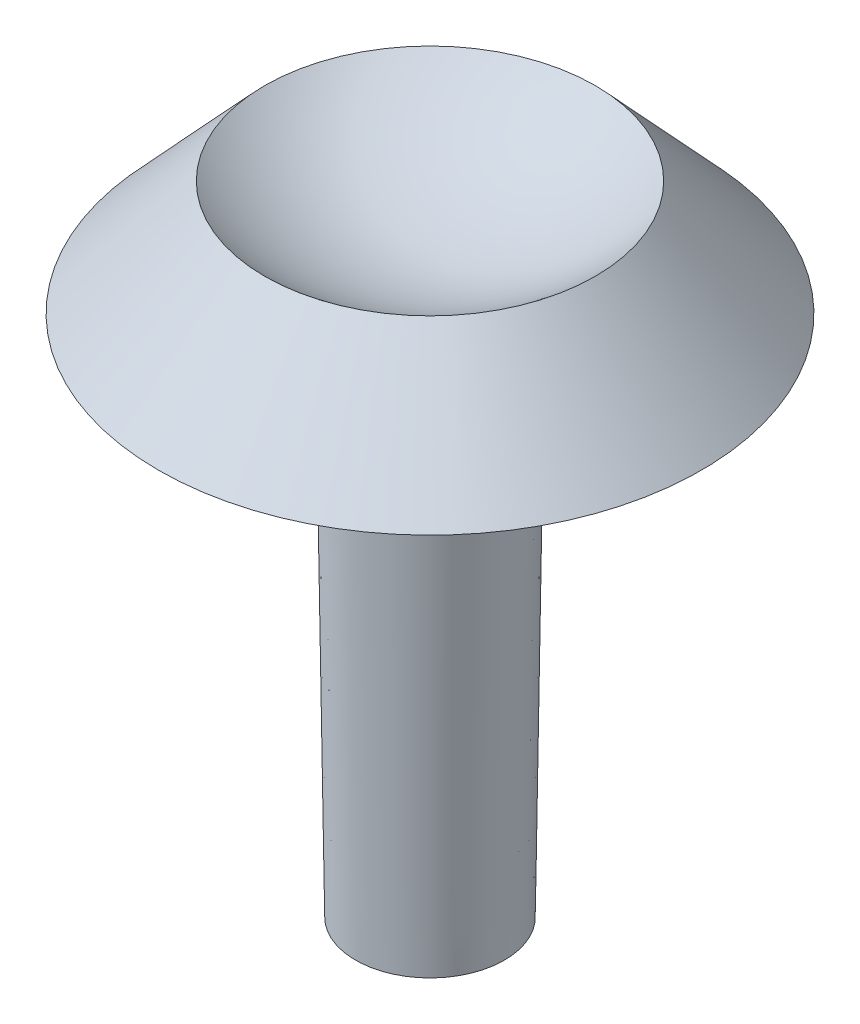
from build123d import *

# Parameters (mm, degrees)
BOSS_EXTRUDE4_DEPTH = 0.5


with BuildPart() as part:
    # Sketch1 → Revolve2 (revolve)
    with BuildSketch(Plane.XY, mode=Mode.PRIVATE) as revolve2_sk:
        with BuildLine():
            Line((2.9, -27.1), (2.9, -41.1))
            Line((2.9, -41.1), (4.8, -41.1))
            Line((4.8, -41.1), (5.25, -7.4))
            Line((5.25, -7.4), (5.25, -5.22209402))
            add(Edge.make_bspline(
                [(5.25, -5.22209402), (8.095465394, -4.432681121), (10.448786446, -2.724006935)],
                knots=[0.39038626, 0.39038626, 0.39038626, 0.844986099, 0.844986099, 0.844986099], degree=2))
            Line((10.448786446, -2.724006935), (14.775237313, -7.4))
            Line((14.775237313, -7.4), (17.5, -7.4))
            Line((17.5, -7.4), (10.653168543, 0))
            ThreePointArc((10.653168543, 0), (5.67230112, -2.89435381), (0, -3.9))
            Line((0, -3.9), (0, -27.1))
            Line((0, -27.1), (2.9, -27.1))
        make_face()
    revolve(revolve2_sk.sketch.rotate(Axis((0, -27.1, 0), (0, 1, 0)), 90), axis=Axis((0, -27.1, 0), (0, 1, 0)))


with BuildPart() as body_2:
    # Sketch3 → Boss-Extrude4 (new, symmetric)
    with BuildSketch(Plane(origin=(0, 0, 0), x_dir=(0, 0, -1), z_dir=(1, 0, 0))):
        with BuildLine():
            Line((-5.249999567, -5.222094021), (-12.760135263, -5.222094021))
            Line((-12.760135263, -5.222094021), (-10.448786446, -2.724006935))
            add(Edge.make_bspline(
                [(-10.448786446, -2.724006935), (-8.814864104, -3.879708006), (-7.089835359, -4.664035636), (-5.249999567, -5.222094021)],
                knots=[0, 0, 0, 0, 1, 1, 1, 1], degree=3))
        make_face()
    extrude(amount=BOSS_EXTRUDE4_DEPTH, both=True)


solid = Compound([part.part, body_2.part])
